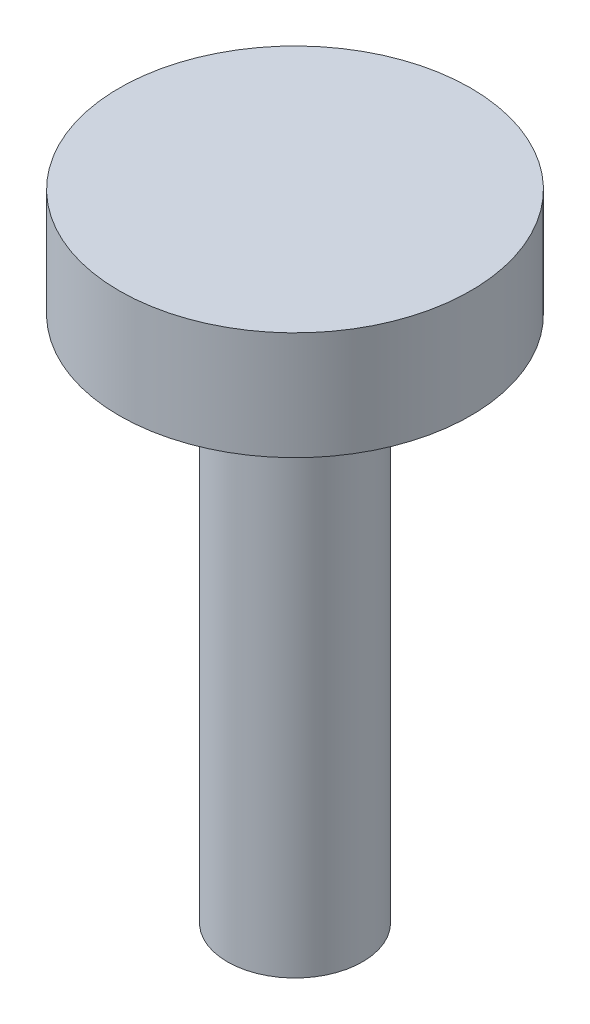
from build123d import *

# Parameters (mm, degrees)
SKETCH1_R           = 1
BOSS_EXTRUDE1_DEPTH = 7.8
SKETCH2_R           = 2.6
BOSS_EXTRUDE2_DEPTH = 1.6


with BuildPart() as part:
    # Sketch1 → Boss-Extrude1 (new body)
    with BuildSketch(Plane(origin=(0, 0, 0), x_dir=(1, 0, 0), z_dir=(0, 1, 0))):
        with Locations(Location((0, 0, 0), (0, 0, 270))):
            Circle(SKETCH1_R)
    extrude(amount=BOSS_EXTRUDE1_DEPTH)

    # Sketch2 → Boss-Extrude2 (add)
    with BuildSketch(Plane(origin=(0, 7.8, 0), x_dir=(1, 0, 0), z_dir=(0, 1, 0))):
        with Locations(Location((0, 0, 0), (0, 0, 270))):
            Circle(SKETCH2_R)
    extrude(amount=BOSS_EXTRUDE2_DEPTH)


solid = part.part
